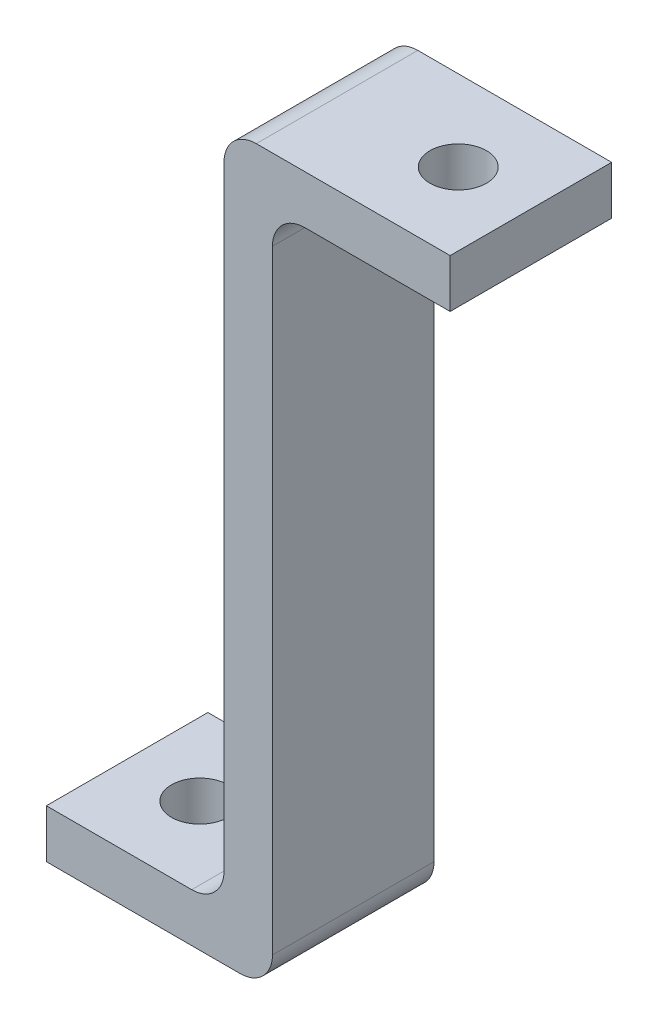
from build123d import *

# Parameters (mm, degrees)
BOSS_EXTRUDE1_DEPTH   = 10
FILLET1_R             = 2
F_3_0MM_DOWEL_HOLE1_D = 3.5
F_3_0MM_DOWEL_HOLE2_D = 3.5


with BuildPart() as part:
    # Sketch1 → Boss-Extrude1 (new body)
    with BuildSketch(Plane.XY):
        Polygon((0, 0), (14, 0), (14, 42), (25, 42), (25, 45), (11, 45), (11, 3), (0, 3), align=None)
    extrude(amount=-BOSS_EXTRUDE1_DEPTH)

    # Fillet1
    fillet1_edges = [part.edges().sort_by_distance(p)[0] for p in [
        (11, 3, -5),
        (11, 45, -5),
        (14, 42, -5),
        (14, 0, -5),
    ]]
    fillet(fillet1_edges, radius=FILLET1_R)

    # Ø3.0mm Dowel Hole1 (through all)
    with Locations(Plane(origin=(4.5, 0, -5), x_dir=(0, 0, -1), z_dir=(0, -1, 0))):
        with Locations((0, 0)):
            Hole(F_3_0MM_DOWEL_HOLE1_D / 2)

    # Ø3.0mm Dowel Hole2 (through all)
    with Locations(Plane(origin=(0, 45, 0), x_dir=(1, 0, 0), z_dir=(0, 1, 0))):
        with Locations((20.5, 5)):
            Hole(F_3_0MM_DOWEL_HOLE2_D / 2)


solid = part.part
